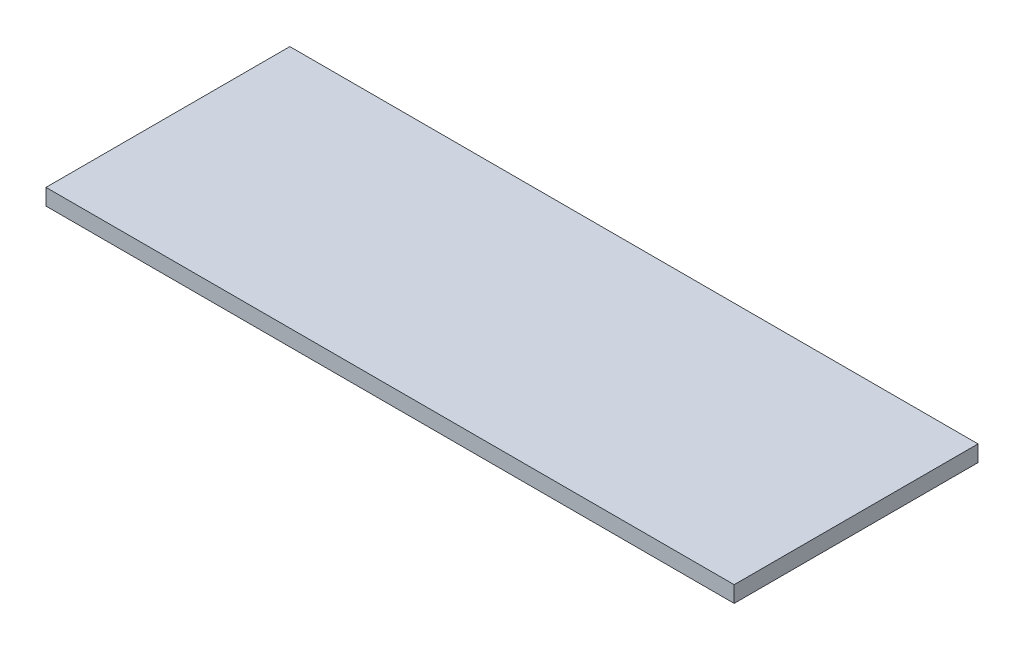
from build123d import *

# Parameters (mm, degrees)
SKETCH_1_W      = 1270
SKETCH_1_H      = 450
EXTRUDE_1_DEPTH = 30


with BuildPart() as part:
    # Эскиз1 → Бобышка-Вытянуть1 (new body)
    with BuildSketch(Plane(origin=(0, 0, 0), x_dir=(1, 0, 0), z_dir=(0, 1, 0))):
        with Locations((635, 225)):
            Rectangle(SKETCH_1_W, SKETCH_1_H)
    extrude(amount=EXTRUDE_1_DEPTH)


solid = part.part
